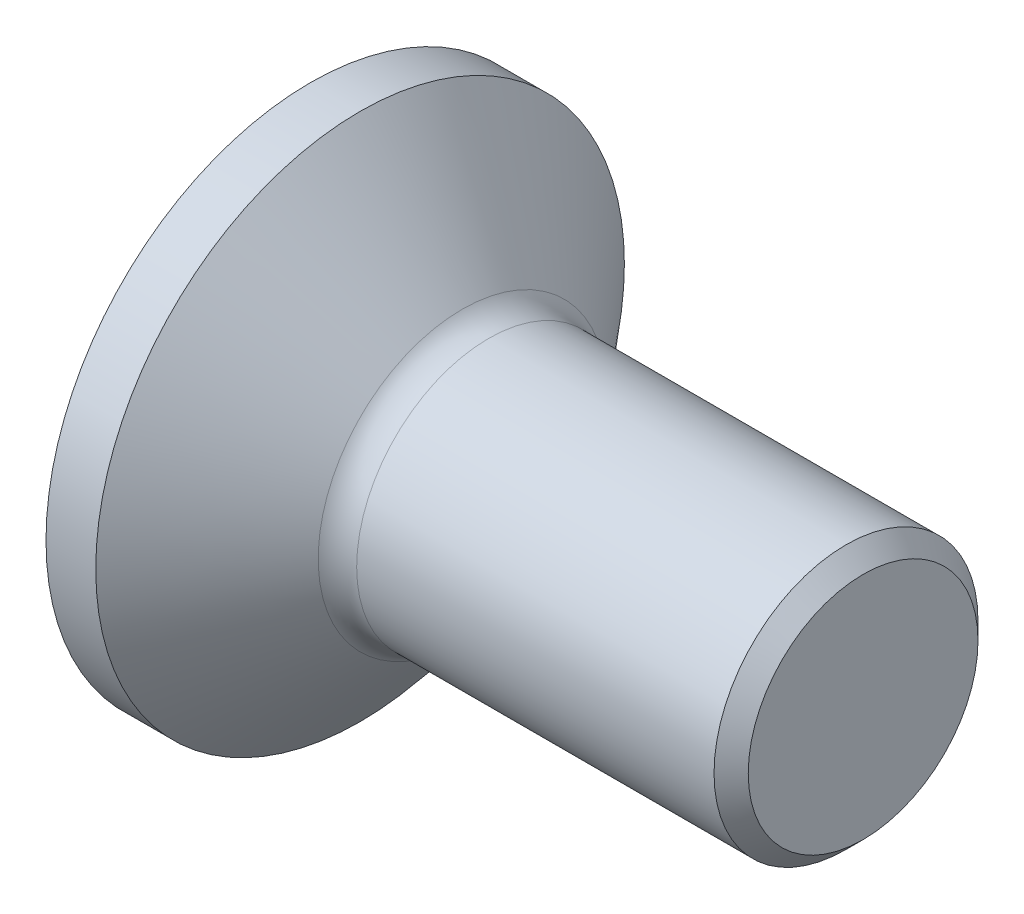
from build123d import *

# Parameters (mm, degrees)
CUT_EXTRUDE1_DEPTH = 1.5


with BuildPart() as part:
    # Sketch1 → Revolve1 (revolve)
    with BuildSketch(Plane.XY):
        with BuildLine():
            Line((2.580774618, 1.91), (7.752512627, 1.91))
            Line((7.752512627, 1.91), (8, 1.662512627))
            Line((8, 1.662512627), (8, 0))
            Line((8, 0), (0, 0))
            Line((0, 0), (0, 3.825))
            Line((0, 3.825), (0.72, 3.825))
            Line((0.72, 3.825), (2.2, 2.08594647))
            ThreePointArc((2.2, 2.08594647), (2.37104475, 1.956113029), (2.580774618, 1.91))
        make_face()
    revolve(axis=Axis((0, 0, 0), (-1, 0, 0)))

    # Sketch2 → Cut-Extrude1 (cut)
    with BuildSketch(Plane.ZY):
        Polygon((1.25, 0.721687836), (0, 1.443375673), (-1.25, 0.721687836), (-1.25, -0.721687836), (0, -1.443375673), (1.25, -0.721687836), align=None)
    extrude(amount=-CUT_EXTRUDE1_DEPTH, mode=Mode.SUBTRACT)


solid = part.part
